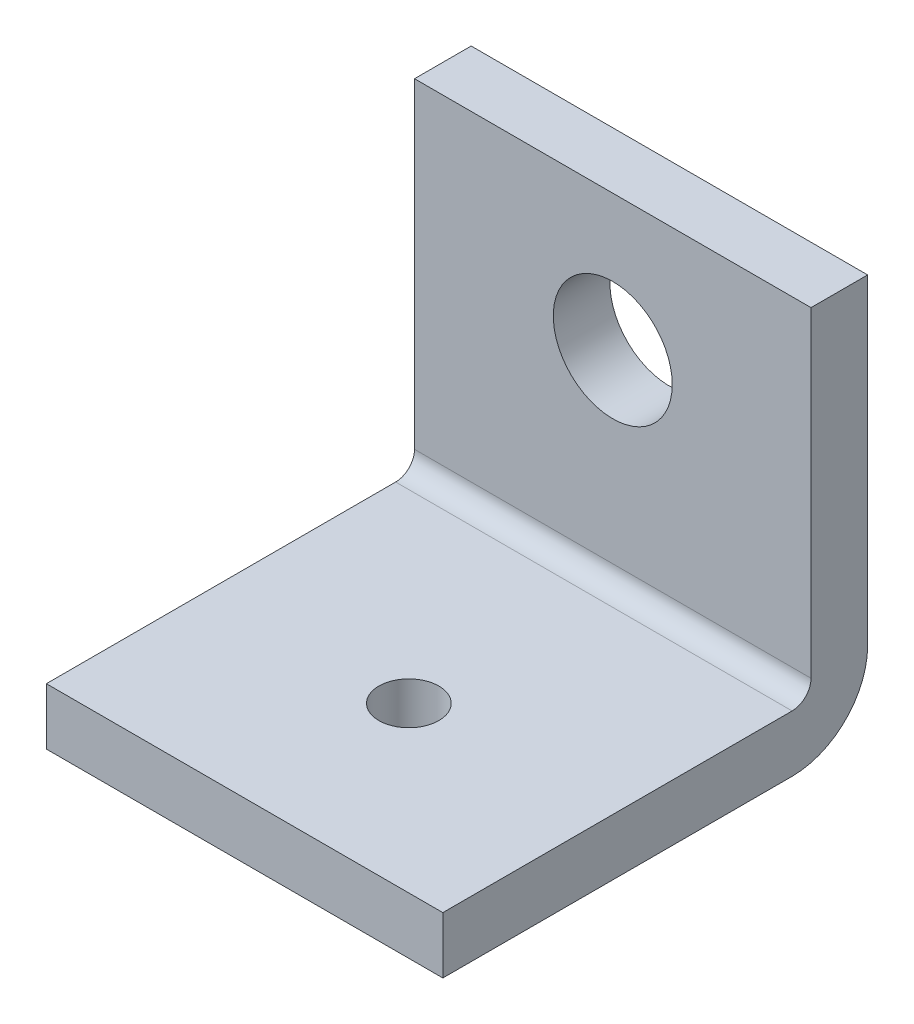
from build123d import *

# Parameters (mm, degrees)
EXTRUDE1_DEPTH = 21
SKETCH3_R      = 1.5875
EXTRUDE2_DEPTH = 3
SKETCH4_R      = 3.15
EXTRUDE3_DEPTH = 3


with BuildPart() as part:
    # Sketch2 → Extrude1 (new body)
    with BuildSketch(Plane(origin=(0, 0, 0), x_dir=(0, 0, -1), z_dir=(1, 0, 0))):
        with BuildLine():
            Line((0, 4), (0, 21))
            Line((0, 21), (-3, 21))
            Line((-3, 21), (-3, 4))
            ThreePointArc((-3, 4), (-3.292893219, 3.292893219), (-4, 3))
            Line((-4, 3), (-22.5, 3))
            Line((-22.5, 3), (-22.5, 0))
            Line((-22.5, 0), (-4, 0))
            ThreePointArc((-4, 0), (-1.171572875, 1.171572875), (0, 4))
        make_face()
    extrude(amount=EXTRUDE1_DEPTH)

    # Sketch3 → Extrude2 (cut)
    with BuildSketch(Plane(origin=(0, 3, 0), x_dir=(1, 0, 0), z_dir=(0, 1, 0))):
        with Locations(Location((10.5, -13.8, 0), (0, 0, 270))):
            Circle(SKETCH3_R)
    extrude(amount=-EXTRUDE2_DEPTH, mode=Mode.SUBTRACT)

    # Sketch4 → Extrude3 (cut)
    with BuildSketch(Plane.XY.offset(3)):
        with Locations((10.5, 13.8)):
            Circle(SKETCH4_R)
    extrude(amount=-EXTRUDE3_DEPTH, mode=Mode.SUBTRACT)


solid = part.part
